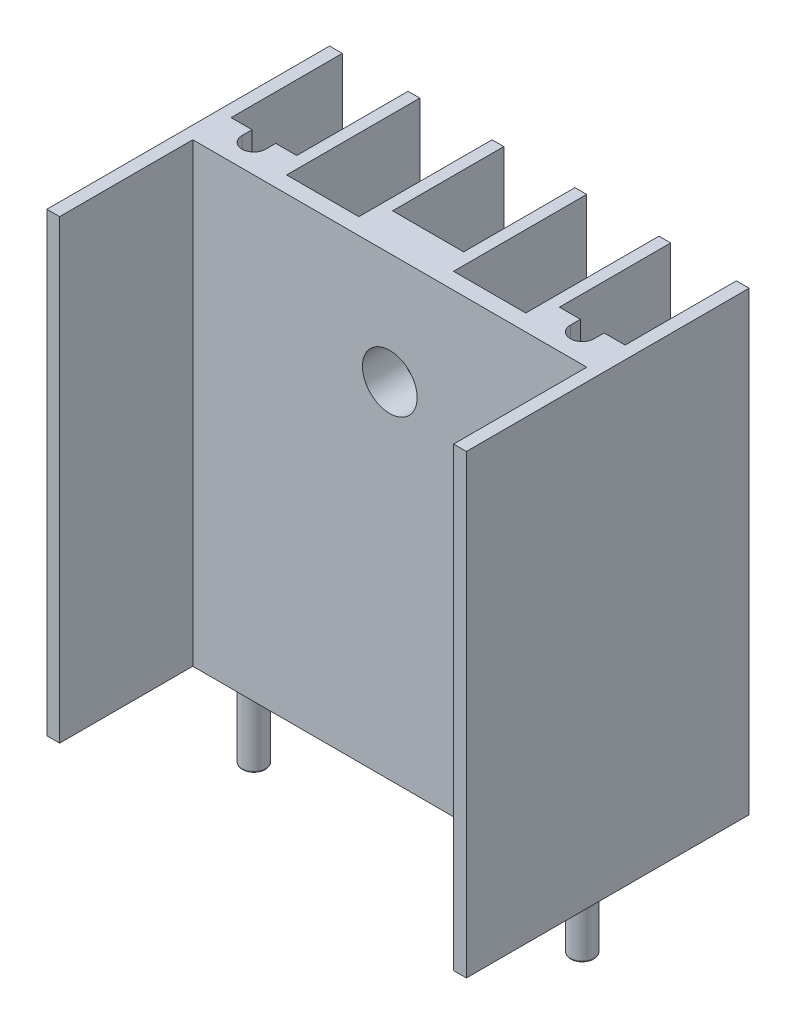
from build123d import *

# Parameters (mm, degrees)
SKETCH1_W                  = 23
SKETCH1_H                  = 15.5
HEIGHT_DEPTH               = 25
SKETCH2_W                  = 3.9
SKETCH2_H                  = 6.1
SKETCH2_W_2                = 3.961996068
SKETCH2_H_2                = 7.3
SKETCH2_W_3                = 21.6
PROFILE_CUT_DEPTH          = 29.588677829
BOSS_EXTRUDE2_DEPTH        = 4.5
BOSS_EXTRUDE2_DEPTH_BACK   = 7.3
SKETCH3_R                  = 0.65
BOSS_EXTRUDE2_2_DEPTH      = 4.5
BOSS_EXTRUDE2_2_DEPTH_BACK = 7.3
FILLET1_R                  = 0.1
FILLET2_R                  = 0.1
SKETCH4_R                  = 1.5
CUT_EXTRUDE2_DEPTH         = 30.079374134


with BuildPart() as part:
    # Sketch1 → Height (new body)
    with BuildSketch(Plane(origin=(0, 0, 0), x_dir=(1, 0, 0), z_dir=(0, 1, 0))):
        Rectangle(SKETCH1_W, SKETCH1_H)
    extrude(amount=HEIGHT_DEPTH)

    # Sketch2 → Profile Cut (cut, through all)
    with BuildSketch(Plane(origin=(0, 25, 0), x_dir=(1, 0, 0), z_dir=(0, 1, 0))):
        with Locations((0, 4.7)):
            Rectangle(SKETCH2_W, SKETCH2_H)
        with BuildLine():
            Line((-10.8, 7.75), (-7.2, 7.75))
            Line((-7.2, 7.75), (-7.2, 1.65))
            Line((-7.2, 1.65), (-8.35, 1.65))
            Line((-8.35, 1.65), (-8.35, 1.1))
            ThreePointArc((-8.35, 1.1), (-9, 0.45), (-9.65, 1.1))
            Line((-9.65, 1.1), (-9.65, 1.65))
            Line((-9.65, 1.65), (-10.8, 1.65))
            Line((-10.8, 1.65), (-10.8, 7.75))
        make_face()
        with BuildLine():
            Line((10.8, 7.75), (7.2, 7.75))
            Line((7.2, 7.75), (7.2, 1.65))
            Line((7.2, 1.65), (8.35, 1.65))
            Line((8.35, 1.65), (8.35, 1.1))
            ThreePointArc((8.35, 1.1), (9, 0.45), (9.65, 1.1))
            Line((9.65, 1.1), (9.65, 1.65))
            Line((9.65, 1.65), (10.8, 1.65))
            Line((10.8, 1.65), (10.8, 7.75))
        make_face()
        with Locations((-4.575, 4.1)):
            Rectangle(SKETCH2_W_2, SKETCH2_H_2)
        with Locations((4.575, 4.1)):
            Rectangle(SKETCH2_W_2, SKETCH2_H_2)
        with Locations((0, -4.1)):
            Rectangle(SKETCH2_W_3, SKETCH2_H_2)
    extrude(amount=-PROFILE_CUT_DEPTH, mode=Mode.SUBTRACT)

    # Sketch4 → Cut-Extrude2 (cut, through all)
    with BuildSketch(Plane(origin=(0, 0, -1.65), x_dir=(-1, 0, 0), z_dir=(0, 0, -1))):
        with Locations((0, 18.9)):
            Circle(SKETCH4_R)
    extrude(amount=-CUT_EXTRUDE2_DEPTH, mode=Mode.SUBTRACT)


with BuildPart() as body_2:
    # Sketch3 → Boss-Extrude2 (new, two sides: drawn at the far end of the back side and taken through both)
    with BuildSketch(Plane.XZ.offset(-BOSS_EXTRUDE2_DEPTH_BACK)):
        with Locations(Location((-9, -1.1, 0), (0, 0, 270))):
            Circle(SKETCH3_R)
    extrude(amount=BOSS_EXTRUDE2_DEPTH + BOSS_EXTRUDE2_DEPTH_BACK)

    # Fillet2
    fillet2_edges = [body_2.edges().sort_by_distance(p)[0] for p in [
        (-9, -4.5, -0.45),
        (-9, 7.3, -0.45),
    ]]
    fillet(fillet2_edges, radius=FILLET2_R)


with BuildPart() as body_3:
    # Sketch3 → Boss-Extrude2 2 (new, two sides: drawn at the far end of the back side and taken through both)
    with BuildSketch(Plane.XZ.offset(-BOSS_EXTRUDE2_2_DEPTH_BACK)):
        with Locations(Location((9, -1.1, 0), (0, 0, 270))):
            Circle(SKETCH3_R)
    extrude(amount=BOSS_EXTRUDE2_2_DEPTH + BOSS_EXTRUDE2_2_DEPTH_BACK)

    # Fillet1
    fillet1_edges = [body_3.edges().sort_by_distance(p)[0] for p in [
        (9, -4.5, -0.45),
        (9, 7.3, -0.45),
    ]]
    fillet(fillet1_edges, radius=FILLET1_R)


solid = Compound([part.part, body_2.part, body_3.part])
